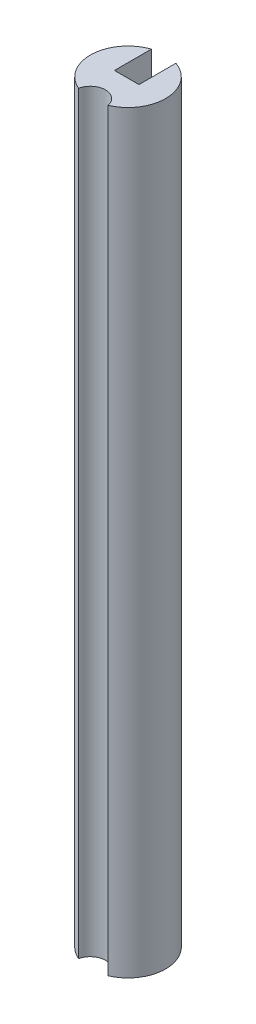
from build123d import *

# Parameters (mm, degrees)
RESSALTO_EXTRUS_O1_DEPTH = 200


with BuildPart() as part:
    # Esboço1 → Ressalto-extrusão1 (new body)
    with BuildSketch(Plane(origin=(0, 0, 0), x_dir=(1, 0, 0), z_dir=(0, 1, 0))):
        with BuildLine():
            Line((-3.25, -0.34285984), (3.25, -0.34285984))
            Line((3.25, -0.34285984), (3.25, 9.45714016))
            ThreePointArc((3.25, 9.45714016), (9.993573839, 0.358443767), (3.919183588, -9.2))
            ThreePointArc((3.919183588, -9.2), (0, -6), (-3.919183588, -9.2))
            ThreePointArc((-3.919183588, -9.2), (-9.993573839, 0.358443767), (-3.25, 9.45714016))
            Line((-3.25, 9.45714016), (-3.25, -0.34285984))
        make_face()
    extrude(amount=RESSALTO_EXTRUS_O1_DEPTH)


solid = part.part
